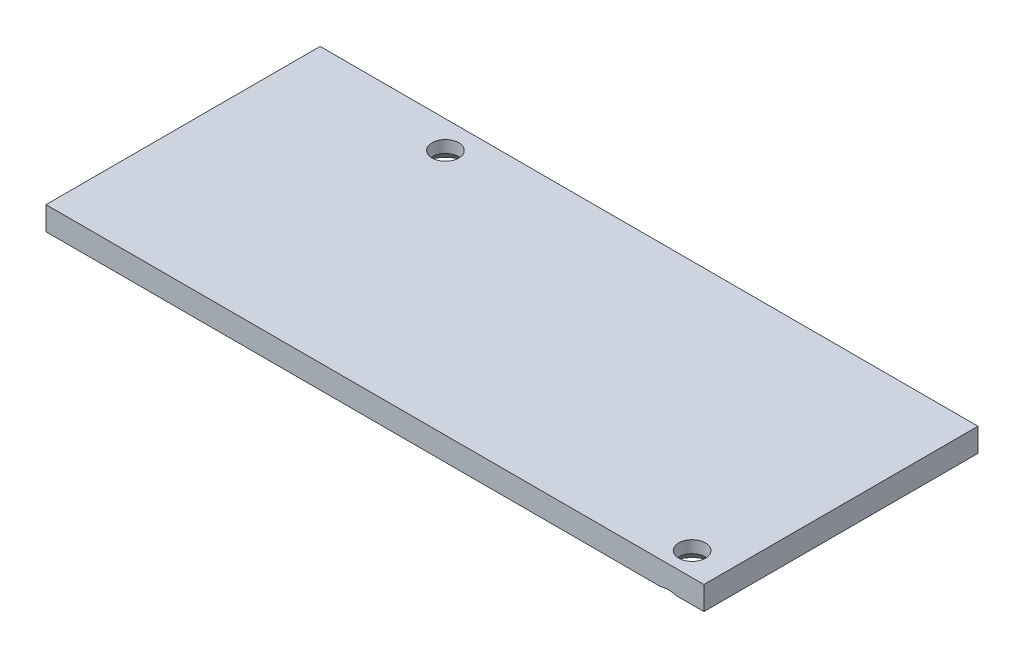
from build123d import *

# Parameters (mm, degrees)
SKETCH1_W                                      = 84
SKETCH1_H                                      = 35
BOSS_EXTRUDE1_DEPTH                            = 3
CSK_FOR_M3_FLAT_HEAD_MACHINE_SCREW1_AT_2_COUNT = 2
CSK_FOR_M3_FLAT_HEAD_MACHINE_SCREW1_AT_2_PITCH = 66.424769476


with BuildPart() as part:
    # Sketch1 → Boss-Extrude1 (new body)
    with BuildSketch(Plane(origin=(0, 0, 0), x_dir=(1, 0, 0), z_dir=(0, 1, 0))):
        Rectangle(SKETCH1_W, SKETCH1_H)
    extrude(amount=BOSS_EXTRUDE1_DEPTH)

    # Sketch5 → CSK for M3 Flat Head Machine Screw1 (revolve, cut)
    with BuildSketch(Plane(origin=(37.5, 0, 14.5), x_dir=(0, 0, -1), z_dir=(1, 0, 0))):
        Polygon((0, 0), (0, 3), (1.7, 3), (1.7, 1.45), (3.15, 0), align=None)
    csk_for_m3_flat_head_machine_screw1 = revolve(axis=Axis((37.5, -6.35, 14.5), (0, 1, 0)), mode=Mode.SUBTRACT)

    # CSK for M3 Flat Head Machine Screw1 at 2: CSK for M3 Flat Head Machine Screw1 ×2
    with Locations(*[Vector(-0.9032775043542898, 0, -0.4290568145682877) * (i * CSK_FOR_M3_FLAT_HEAD_MACHINE_SCREW1_AT_2_PITCH) for i in range(1, CSK_FOR_M3_FLAT_HEAD_MACHINE_SCREW1_AT_2_COUNT)]):
        add(csk_for_m3_flat_head_machine_screw1, mode=Mode.SUBTRACT)


solid = part.part
